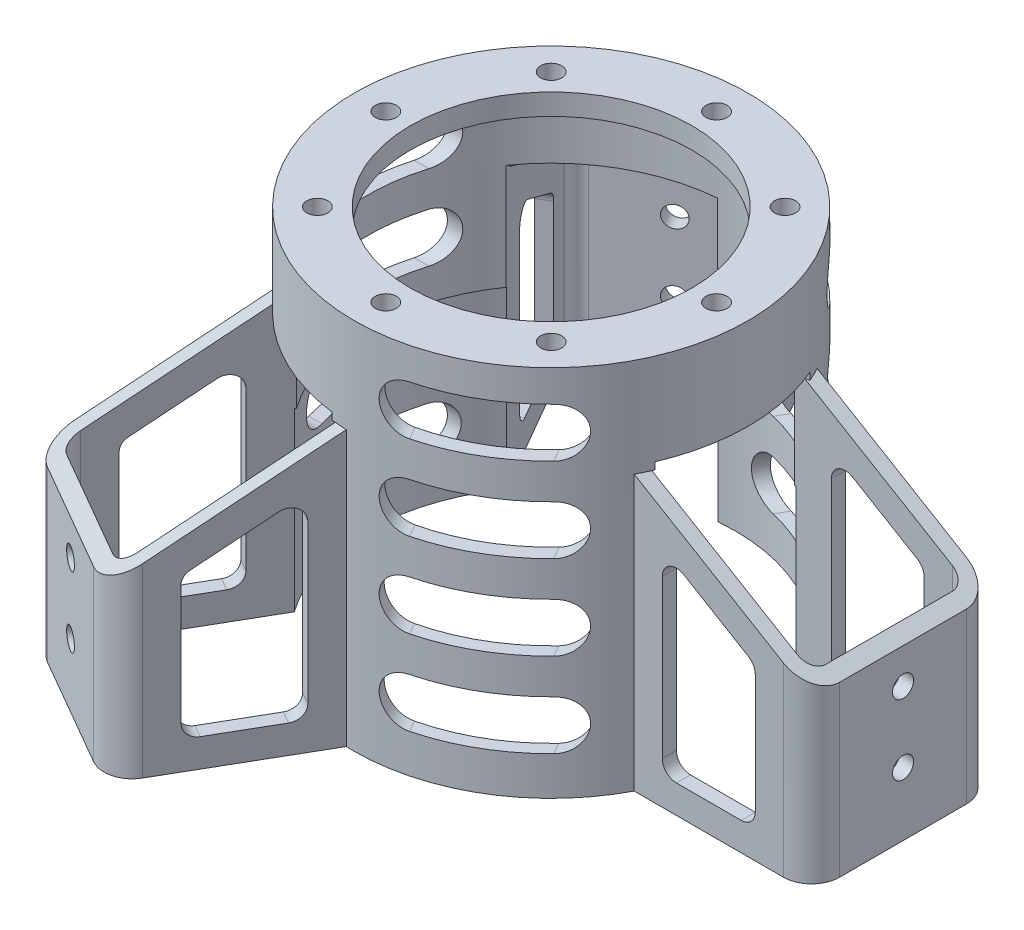
from build123d import *

# Parameters (mm, degrees)
SKETCH_1_W               = 2
SKETCH_1_H               = 50
EXTRUDE_START            = 3
SKETCH_17_R              = 28
SKETCH_17_R_2            = 20
SKETCH_17_R_3            = 1.5
EXTRUDE_4_DEPTH          = 3
EXTRUDE_START_2          = -39
EXTRUDE_2_DEPTH          = 39
SKETCH_11_W              = 13.421878685
SKETCH_11_H              = 22
CUT_EXTRUDE_6_DEPTH      = 40
SKETCH_13_R              = 1.5
CUT_EXTRUDE_8_DEPTH      = 10
PATTERN_CIRCULAR_3_COUNT = 3
CUT_EXTRUDE_11_DEPTH     = 40
PATTERN_CIRCULAR_4_COUNT = 3
SKETCH_15_R              = 26.2
CUT_EXTRUDE_10_DEPTH     = 25
CUT_EXTRUDE_12_DEPTH     = 40
PATTERN_CIRCULAR_5_COUNT = 3
CUT_EXTRUDE_13_DEPTH     = 40
PATTERN_CIRCULAR_6_COUNT = 3


with BuildPart() as part:
    # 草图1 → 旋转1 (revolve)
    with BuildSketch(Plane.XY, mode=Mode.PRIVATE) as revolve_1_sk:
        with Locations((27, 25)):
            Rectangle(SKETCH_1_W, SKETCH_1_H)
    revolve(revolve_1_sk.sketch.rotate(Axis((0, 49.060914686, 0), (0, -1, 0)), 90), axis=Axis((0, 49.060914686, 0), (0, -1, 0)))

    # 草图17 → 凸台-拉伸4 (add)
    with BuildSketch(Plane(origin=(0, 50, 0), x_dir=(1, 0, 0), z_dir=(0, 1, 0)).offset(EXTRUDE_START)):
        with Locations(Location((0, 0, 0), (0, 0, 270))):
            Circle(SKETCH_17_R)
        with Locations(Location((0, 0, 0), (0, 0, 270))):
            Circle(SKETCH_17_R_2, mode=Mode.SUBTRACT)
        with Locations(Location((0, 23.5, 0), (0, 0, 270))):
            Circle(SKETCH_17_R_3, mode=Mode.SUBTRACT)
        with Locations(Location((16.617009358, 16.617009358, 0), (0, 0, 270))):
            Circle(SKETCH_17_R_3, mode=Mode.SUBTRACT)
        with Locations(Location((23.5, 0, 0), (0, 0, 270))):
            Circle(SKETCH_17_R_3, mode=Mode.SUBTRACT)
        with Locations(Location((16.617009358, -16.617009358, 0), (0, 0, 270))):
            Circle(SKETCH_17_R_3, mode=Mode.SUBTRACT)
        with Locations(Location((0, -23.5, 0), (0, 0, 270))):
            Circle(SKETCH_17_R_3, mode=Mode.SUBTRACT)
        with Locations(Location((-16.617009358, -16.617009358, 0), (0, 0, 270))):
            Circle(SKETCH_17_R_3, mode=Mode.SUBTRACT)
        with Locations(Location((-23.5, 0, 0), (0, 0, 270))):
            Circle(SKETCH_17_R_3, mode=Mode.SUBTRACT)
        with Locations(Location((-16.617009358, 16.617009358, 0), (0, 0, 270))):
            Circle(SKETCH_17_R_3, mode=Mode.SUBTRACT)
    extrude(amount=-EXTRUDE_4_DEPTH)

    # 草图10 → 凸台-拉伸2 (add)
    # profile 1 of 3: a face of its own
    with BuildSketch(Plane.XZ.offset(EXTRUDE_START_2)):
        with BuildLine():
            Line((-1.141266518, 27.976731595), (-11.741669751, 46.337168574))
            ThreePointArc((-11.741669751, 46.337168574), (-14.170495186, 48.200871879), (-17.205771366, 47.801270189))
            Line((-17.205771366, 47.801270189), (-32.794228634, 38.801270189))
            ThreePointArc((-32.794228634, 38.801270189), (-34.657931939, 36.372444754), (-34.258330249, 33.337168574))
            Line((-34.258330249, 33.337168574), (-23.657927017, 14.976731595))
            ThreePointArc((-23.657927017, 14.976731595), (-14, 24.248711306), (-1.141266518, 27.976731595))
        make_face()
        with BuildLine():
            Line((-4.429006295, 29.671263931), (-13.473720558, 45.337168574))
            ThreePointArc((-13.473720558, 45.337168574), (-14.688133276, 46.269020227), (-16.205771366, 46.069219382))
            Line((-16.205771366, 46.069219382), (-31.794228634, 37.069219382))
            ThreePointArc((-31.794228634, 37.069219382), (-32.726080287, 35.854806664), (-32.526279442, 34.337168574))
            Line((-32.526279442, 34.337168574), (-23.481565179, 18.671263931))
            ThreePointArc((-23.481565179, 18.671263931), (-15, 25.980762114), (-4.429006295, 29.671263931))
        make_face(mode=Mode.SUBTRACT)
    # profile 2 of 3: a face of its own
    with BuildSketch(Plane.XZ.offset(EXTRUDE_START_2)):
        with BuildLine():
            Line((24.799193535, -13), (46, -13))
            ThreePointArc((46, -13), (48.828427125, -11.828427125), (50, -9))
            Line((50, -9), (50, 9))
            ThreePointArc((50, 9), (48.828427125, 11.828427125), (46, 13))
            Line((46, 13), (24.799193535, 13))
            ThreePointArc((24.799193535, 13), (28, 0), (24.799193535, -13))
        make_face()
        with BuildLine():
            Line((27.910571474, -11), (46, -11))
            ThreePointArc((46, -11), (47.414213562, -10.414213562), (48, -9))
            Line((48, -9), (48, 9))
            ThreePointArc((48, 9), (47.414213562, 10.414213562), (46, 11))
            Line((46, 11), (27.910571474, 11))
            ThreePointArc((27.910571474, 11), (30, 0), (27.910571474, -11))
        make_face(mode=Mode.SUBTRACT)
    # profile 3 of 3: a face of its own
    with BuildSketch(Plane.XZ.offset(EXTRUDE_START_2)):
        with BuildLine():
            Line((-23.657927017, -14.976731595), (-34.258330249, -33.337168574))
            ThreePointArc((-34.258330249, -33.337168574), (-34.657931939, -36.372444754), (-32.794228634, -38.801270189))
            Line((-32.794228634, -38.801270189), (-17.205771366, -47.801270189))
            ThreePointArc((-17.205771366, -47.801270189), (-14.170495186, -48.200871879), (-11.741669751, -46.337168574))
            Line((-11.741669751, -46.337168574), (-1.141266518, -27.976731595))
            ThreePointArc((-1.141266518, -27.976731595), (-14, -24.248711306), (-23.657927017, -14.976731595))
        make_face()
        with BuildLine():
            Line((-23.481565179, -18.671263931), (-32.526279442, -34.337168574))
            ThreePointArc((-32.526279442, -34.337168574), (-32.726080287, -35.854806664), (-31.794228634, -37.069219382))
            Line((-31.794228634, -37.069219382), (-16.205771366, -46.069219382))
            ThreePointArc((-16.205771366, -46.069219382), (-14.688133276, -46.269020227), (-13.473720558, -45.337168574))
            Line((-13.473720558, -45.337168574), (-4.429006295, -29.671263931))
            ThreePointArc((-4.429006295, -29.671263931), (-15, -25.980762114), (-23.481565179, -18.671263931))
        make_face(mode=Mode.SUBTRACT)
    extrude(amount=EXTRUDE_2_DEPTH)

    # 草图11 → 切除-拉伸6 (cut)
    with BuildSketch(Plane(origin=(0, 0, 0), x_dir=(1, 0, 0), z_dir=(0, 1, 0))):
        Polygon((-25.432826817, -22.050948227), (-18.721887474, -10.427260319), (0.330671409, -21.427260319), (-6.380267934, -33.050948227), align=None)
        Polygon((-6.380267934, 33.050948227), (-25.432826817, 22.050948227), (-18.721887474, 10.427260319), (0.330671409, 21.427260319), align=None)
        with Locations((25.102155409, 0)):
            Rectangle(SKETCH_11_W, SKETCH_11_H)
    extrude(amount=CUT_EXTRUDE_6_DEPTH, mode=Mode.SUBTRACT)

    # 草图13 → 切除-拉伸8 (cut)
    with BuildSketch(Plane(origin=(-25, 0, -43.301270189), x_dir=(-0.8660254037844393, 0, 0.49999999999999906), z_dir=(-0.499999999999999, 0, -0.8660254037844392))):
        with Locations((0, 19)):
            Circle(SKETCH_13_R)
        with Locations((0, 9)):
            Circle(SKETCH_13_R)
    cut_extrude_8 = extrude(amount=-CUT_EXTRUDE_8_DEPTH, mode=Mode.SUBTRACT)

    # 阵列(圆周)3: 切除-拉伸8 ×3 about axis
    pattern_circular_3_axis = Axis((0, 53, 0), (0, 1, 0))
    for i in range(1, PATTERN_CIRCULAR_3_COUNT):
        add(cut_extrude_8.rotate(pattern_circular_3_axis, i * 360 / PATTERN_CIRCULAR_3_COUNT), mode=Mode.SUBTRACT)

    # 草图18 → 切除-拉伸11 (cut)
    with BuildSketch(Plane.XY.offset(13)):
        Polygon((24.799193535, 39), (50, 24), (50, 39), align=None)
    cut_extrude_11 = extrude(amount=-CUT_EXTRUDE_11_DEPTH, mode=Mode.SUBTRACT)

    # 阵列(圆周)4: 切除-拉伸11 ×3 about axis
    pattern_circular_4_axis = Axis((0, 0, 0), (0, 1, 0))
    for i in range(1, PATTERN_CIRCULAR_4_COUNT):
        add(cut_extrude_11.rotate(pattern_circular_4_axis, i * 360 / PATTERN_CIRCULAR_4_COUNT), mode=Mode.SUBTRACT)

    # 草图15 → 切除-拉伸10 (cut)
    with BuildSketch(Plane.XZ):
        Circle(SKETCH_15_R)
    extrude(amount=-CUT_EXTRUDE_10_DEPTH, mode=Mode.SUBTRACT)

    # 草图19 → 切除-拉伸12 (cut)
    with BuildSketch(Plane(origin=(0, 0, 0), x_dir=(0, 0, -1), z_dir=(1, 0, 0))):
        with BuildLine():
            Line((7.5, 41.5), (-7.5, 41.5))
            ThreePointArc((-7.5, 41.5), (-11, 45), (-7.5, 48.5))
            Line((-7.5, 48.5), (7.5, 48.5))
            ThreePointArc((7.5, 48.5), (11, 45), (7.5, 41.5))
        make_face()
        with BuildLine():
            Line((7.5, 29.5), (-7.5, 29.5))
            ThreePointArc((-7.5, 29.5), (-11, 33), (-7.5, 36.5))
            Line((-7.5, 36.5), (7.5, 36.5))
            ThreePointArc((7.5, 36.5), (11, 33), (7.5, 29.5))
        make_face()
        with BuildLine():
            Line((7.5, 17.5), (-7.5, 17.5))
            ThreePointArc((-7.5, 17.5), (-11, 21), (-7.5, 24.5))
            Line((-7.5, 24.5), (7.5, 24.5))
            ThreePointArc((7.5, 24.5), (11, 21), (7.5, 17.5))
        make_face()
        with BuildLine():
            Line((7.5, 5.5), (-7.5, 5.5))
            ThreePointArc((-7.5, 5.5), (-11, 9), (-7.5, 12.5))
            Line((-7.5, 12.5), (7.5, 12.5))
            ThreePointArc((7.5, 12.5), (11, 9), (7.5, 5.5))
        make_face()
    cut_extrude_12 = extrude(amount=-CUT_EXTRUDE_12_DEPTH, mode=Mode.SUBTRACT)

    # 阵列(圆周)5: 切除-拉伸12 ×3 about axis
    pattern_circular_5_axis = Axis((0, 0, 0), (0, -1, 0))
    for i in range(1, PATTERN_CIRCULAR_5_COUNT):
        add(cut_extrude_12.rotate(pattern_circular_5_axis, i * 360 / PATTERN_CIRCULAR_5_COUNT), mode=Mode.SUBTRACT)

    # 草图20 → 切除-拉伸13 (cut)
    with BuildSketch(Plane(origin=(0, 0, -13), x_dir=(-1, 0, 0), z_dir=(0, 0, -1))):
        with BuildLine():
            Line((-41.022943547, 24.688363704), (-31.822137082, 30.164858957))
            ThreePointArc((-31.822137082, 30.164858957), (-29.810731875, 30.184920224), (-28.799193535, 28.4462588))
            Line((-28.799193535, 28.4462588), (-28.799193535, 6))
            ThreePointArc((-28.799193535, 6), (-29.384979973, 4.585786438), (-30.799193535, 4))
            Line((-30.799193535, 4), (-40, 4))
            ThreePointArc((-40, 4), (-41.414213562, 4.585786438), (-42, 6))
            Line((-42, 6), (-42, 22.969763547))
            ThreePointArc((-42, 22.969763547), (-41.738661424, 23.958225207), (-41.022943547, 24.688363704))
        make_face()
    cut_extrude_13 = extrude(amount=-CUT_EXTRUDE_13_DEPTH, mode=Mode.SUBTRACT)

    # 阵列(圆周)6: 切除-拉伸13 ×3 about axis
    pattern_circular_6_axis = Axis((0, 0, 0), (0, 1, 0))
    for i in range(1, PATTERN_CIRCULAR_6_COUNT):
        add(cut_extrude_13.rotate(pattern_circular_6_axis, i * 360 / PATTERN_CIRCULAR_6_COUNT), mode=Mode.SUBTRACT)


solid = part.part
